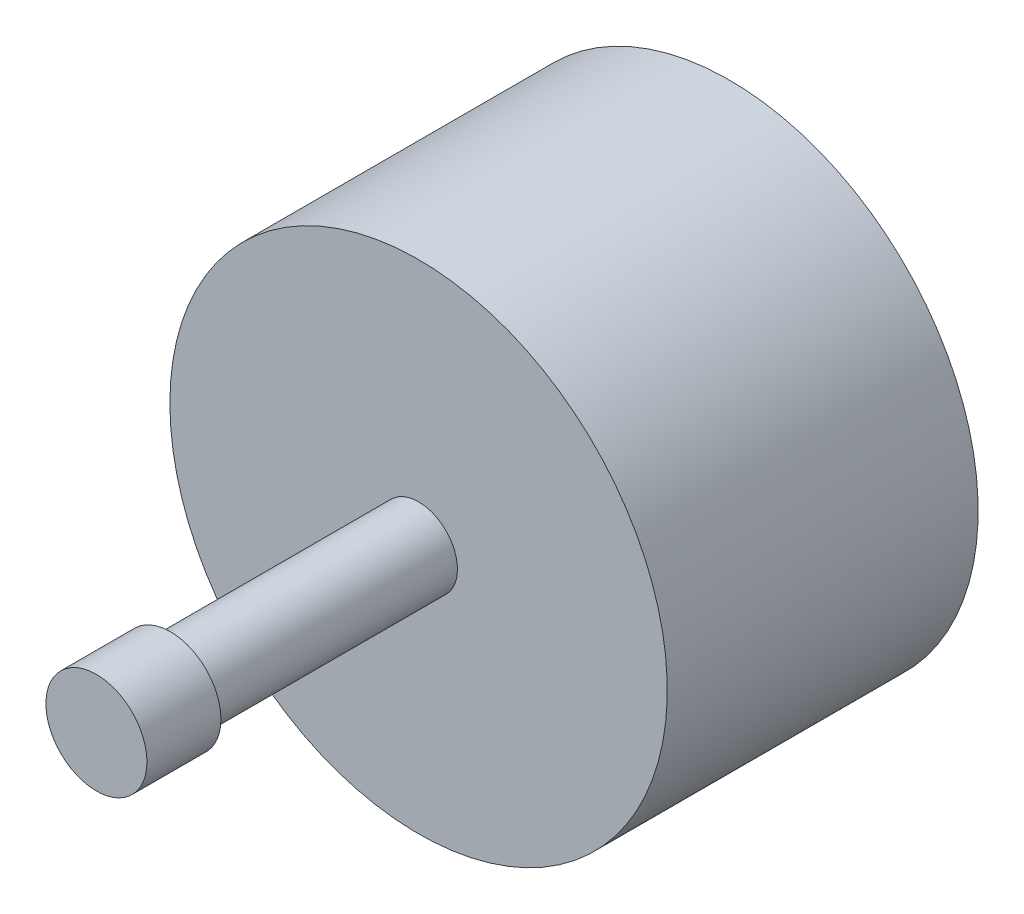
from build123d import *

# Parameters (mm, degrees)
ESBO_O1_R                = 2.5
RESSALTO_EXTRUS_O1_DEPTH = 15.965
ESBO_O2_R                = 3.25
RESSALTO_EXTRUS_O2_DEPTH = 4.76
ESBO_O3_R                = 16
RESSALTO_EXTRUS_O3_DEPTH = 20


with BuildPart() as part:
    # Esboço1 → Ressalto-extrusão1 (new body)
    with BuildSketch(Plane.XY):
        Circle(ESBO_O1_R)
    extrude(amount=RESSALTO_EXTRUS_O1_DEPTH)

    # Esboço2 → Ressalto-extrusão2 (add)
    with BuildSketch(Plane.XY.offset(15.965)):
        Circle(ESBO_O2_R)
    extrude(amount=RESSALTO_EXTRUS_O2_DEPTH)

    # Esboço3 → Ressalto-extrusão3 (add)
    with BuildSketch(Plane(origin=(0, 0, 0), x_dir=(-1, 0, 0), z_dir=(0, 0, -1))):
        Circle(ESBO_O3_R)
    extrude(amount=RESSALTO_EXTRUS_O3_DEPTH)


solid = part.part
